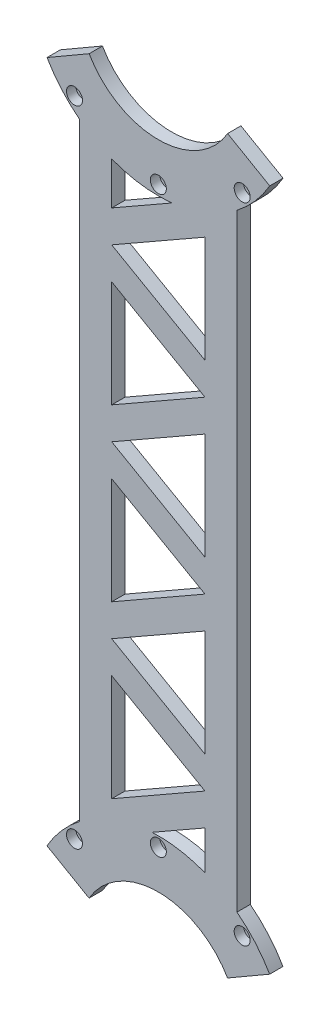
from build123d import *

# Parameters (mm, degrees)
SKETCH1_R           = 48.25
BOSS_EXTRUDE1_DEPTH = 5
SKETCH2_W           = 17.162038191
SKETCH2_H           = 56.822210482
SKETCH2_W_2         = 16.152506533
SKETCH2_H_2         = 65.186901365
CUT_EXTRUDE1_DEPTH  = 8
SKETCH3_R           = 30
CUT_EXTRUDE2_DEPTH  = 8
SKETCH4_R           = 1.75
CUT_EXTRUDE3_DEPTH  = 10
SKETCH9_R           = 3
CUT_EXTRUDE4_DEPTH  = 3.5
SKETCH12_R          = 48.25
BOSS_EXTRUDE4_DEPTH = 5
SKETCH13_W          = 17.162038191
SKETCH13_H          = 240.265998925
SKETCH13_W_2        = 16.152506533
SKETCH13_H_2        = 226.18217938
CUT_EXTRUDE5_DEPTH  = 5
SKETCH14_R          = 30
CUT_EXTRUDE6_DEPTH  = 5
CUT_EXTRUDE7_DEPTH  = 5
CUT_EXTRUDE8_DEPTH  = 5
SKETCH19_R          = 1.75
CUT_EXTRUDE9_DEPTH  = 5
SKETCH20_R          = 3
CUT_EXTRUDE10_DEPTH = 3.5
BOSS_EXTRUDE5_DEPTH = 5
SKETCH21_R          = 30
CUT_EXTRUDE11_DEPTH = 5
SKETCH22_R          = 3
CUT_EXTRUDE12_DEPTH = 3.5


with BuildPart() as part:
    # Sketch1 → Boss-Extrude1 (new body)
    with BuildSketch(Plane.XY):
        Circle(SKETCH1_R)
    extrude(amount=-BOSS_EXTRUDE1_DEPTH)

    # Sketch2 → Cut-Extrude1 (cut)
    with BuildSketch(Plane.XY):
        with Locations((-54.831019095, 0)):
            Rectangle(SKETCH2_W, SKETCH2_H)
        with Locations((54.326253267, -4.182345442)):
            Rectangle(SKETCH2_W_2, SKETCH2_H_2)
    extrude(amount=-CUT_EXTRUDE1_DEPTH, mode=Mode.SUBTRACT)

    # Sketch3 → Cut-Extrude2 (cut)
    with BuildSketch(Plane.XY):
        Circle(SKETCH3_R)
    extrude(amount=-CUT_EXTRUDE2_DEPTH, mode=Mode.SUBTRACT)

    # Sketch4 → Cut-Extrude3 (cut)
    with BuildSketch(Plane.XY):
        with Locations((-42.5, 0)):
            Circle(SKETCH4_R)
        with Locations((0, -44.5)):
            Circle(SKETCH4_R)
        with Locations((0, 44.5)):
            Circle(SKETCH4_R)
        with Locations((42.5, 0)):
            Circle(SKETCH4_R)
        with Locations((-31.466251763, -31.466251763)):
            Circle(SKETCH4_R)
        with Locations((31.466251763, -31.466251763)):
            Circle(SKETCH4_R)
        with Locations((31.466251763, 31.466251763)):
            Circle(SKETCH4_R)
        with Locations((-31.466251763, 31.466251763)):
            Circle(SKETCH4_R)
    extrude(amount=-CUT_EXTRUDE3_DEPTH, mode=Mode.SUBTRACT)

    # Sketch9 → Cut-Extrude4 (cut)
    with BuildSketch(Plane.XY):
        with Locations((-42.5, 0)):
            Circle(SKETCH9_R)
        with Locations((42.5, 0)):
            Circle(SKETCH9_R)
        with Locations((31.466251763, 31.466251763)):
            Circle(SKETCH9_R)
        with Locations((-31.466251763, 31.466251763)):
            Circle(SKETCH9_R)
        with Locations((-31.466251763, -31.466251763)):
            Circle(SKETCH9_R)
        with Locations((31.466251763, -31.466251763)):
            Circle(SKETCH9_R)
        with Locations((0, -44.5)):
            Circle(SKETCH9_R)
        with Locations((0, 44.5)):
            Circle(SKETCH9_R)
    extrude(amount=-CUT_EXTRUDE4_DEPTH, mode=Mode.SUBTRACT)

    # Sketch17 → Cut-Extrude7 (cut)
    with BuildSketch(Plane.XY):
        Polygon((0, 0), (-69.304284442, 39.961433382), (-69.278270797, -65.322297693), (63.970930278, -62.407226987), (69.259758702, 40.038554227), align=None)
    extrude(amount=-CUT_EXTRUDE7_DEPTH, mode=Mode.SUBTRACT)



with BuildPart() as body_2:
    # Sketch12 → Boss-Extrude4 (new body)
    with BuildSketch(Plane.XY):
        with Locations((0, 304.453033425)):
            Circle(SKETCH12_R)
    extrude(amount=-BOSS_EXTRUDE4_DEPTH)

    # Sketch13 → Cut-Extrude5 (cut)
    with BuildSketch(Plane.XY):
        with Locations((-54.831019095, 316.834631882)):
            Rectangle(SKETCH13_W, SKETCH13_H)
        with Locations((54.326253267, 300.281083797)):
            Rectangle(SKETCH13_W_2, SKETCH13_H_2)
    extrude(amount=-CUT_EXTRUDE5_DEPTH, mode=Mode.SUBTRACT)

    # Sketch14 → Cut-Extrude6 (cut)
    with BuildSketch(Plane.XY):
        with Locations((0, 304.453033425)):
            Circle(SKETCH14_R)
    extrude(amount=-CUT_EXTRUDE6_DEPTH, mode=Mode.SUBTRACT)

    # Sketch18 → Cut-Extrude8 (cut)
    with BuildSketch(Plane.XY):
        Polygon((0, 304.453033425), (-69.251773631, 264.400669588), (-69.066382196, 357.511219566), (54.70167511, 362.333351669), (69.31225138, 264.505420122), align=None)
    extrude(amount=-CUT_EXTRUDE8_DEPTH, mode=Mode.SUBTRACT)

    # Sketch19 → Cut-Extrude9 (cut)
    with BuildSketch(Plane.XY):
        with Locations((0, 259.953033425)):
            Circle(SKETCH19_R)
        with Locations((-31.466251763, 272.986781662)):
            Circle(SKETCH19_R)
        with Locations((31.466251763, 272.986781662)):
            Circle(SKETCH19_R)
    extrude(amount=-CUT_EXTRUDE9_DEPTH, mode=Mode.SUBTRACT)

    # Sketch20 → Cut-Extrude10 (cut)
    with BuildSketch(Plane.XY):
        with Locations((-31.466251763, 272.986781662)):
            Circle(SKETCH20_R)
        with Locations((0, 259.953033425)):
            Circle(SKETCH20_R)
        with Locations((31.466251763, 272.986781662)):
            Circle(SKETCH20_R)
    extrude(amount=-CUT_EXTRUDE10_DEPTH, mode=Mode.SUBTRACT)


with BuildPart() as part_1:
    add(part.part)

    add(body_2.part)  # Boss-Extrude5 merges body 2
    # Sketch10 → Boss-Extrude5 (add)
    # profile 1 of 4: a face of its own
    with BuildSketch(Plane.XY):
        with BuildLine():
            Line((-17.5, 243.53997423), (-17.5, 259.48846404))
            ThreePointArc((-17.5, 259.48846404), (-23.743486454, 262.449350837), (-29.5, 266.271722552))
            Line((-29.5, 266.271722552), (-29.5, 38.181310873))
            ThreePointArc((-29.5, 38.181310873), (-16.697131744, 45.268844601), (-2.358379682, 48.192328697))
            Line((-2.358379682, 48.192328697), (17.5, 59.53997423))
            Line((17.5, 59.53997423), (17.5, 44.964569385))
            ThreePointArc((17.5, 44.964569385), (23.743486454, 42.003682588), (29.5, 38.181310873))
            Line((29.5, 38.181310873), (29.5, 266.271722552))
            ThreePointArc((29.5, 266.271722552), (17.999468175, 259.686062951), (5.141024697, 256.477702628))
            Line((5.141024697, 256.477702628), (-17.5, 243.53997423))
        make_face()
        Polygon((17.5, 251.53997423), (17.5, 211.53997423), (-17.5, 231.53997423), align=None, mode=Mode.SUBTRACT)
        Polygon((17.5, 187.53997423), (17.5, 147.53997423), (-17.5, 167.53997423), align=None, mode=Mode.SUBTRACT)
        Polygon((-17.5, 179.53997423), (-17.5, 219.53997423), (17.5, 199.53997423), align=None, mode=Mode.SUBTRACT)
        Polygon((17.5, 135.53997423), (-17.5, 115.53997423), (-17.5, 155.53997423), align=None, mode=Mode.SUBTRACT)
        Polygon((17.5, 123.53997423), (17.5, 83.53997423), (-17.5, 103.53997423), align=None, mode=Mode.SUBTRACT)
        Polygon((17.5, 71.53997423), (-17.5, 51.53997423), (-17.5, 91.53997423), align=None, mode=Mode.SUBTRACT)
    # profile 2 of 4: a face of its own
    with BuildSketch(Plane.XY):
        with BuildLine():
            ThreePointArc((29.101447707, 274.83277781), (28.479675874, 272.7032954), (29.490995443, 270.728826288))
            ThreePointArc((29.490995443, 270.728826288), (29.367996239, 272.787614912), (29.101447707, 274.83277781))
        make_face()
    # profile 3 of 4: a face of its own
    with BuildSketch(Plane.XY):
        with BuildLine():
            ThreePointArc((-29.101447707, 274.83277781), (-29.367996239, 272.787614912), (-29.490995443, 270.728826288))
            ThreePointArc((-29.490995443, 270.728826288), (-28.479675874, 272.7032954), (-29.101447707, 274.83277781))
        make_face()
    # profile 4 of 4: a face of its own
    with BuildSketch(Plane.XY):
        with BuildLine():
            ThreePointArc((-24.25254041, 286.794769533), (0, 274.453033425), (24.25254041, 286.794769533))
            ThreePointArc((24.25254041, 286.794769533), (0, 299.5), (-24.25254041, 286.794769533))
        make_face()
    extrude(amount=-BOSS_EXTRUDE5_DEPTH)

    # Sketch21 → Cut-Extrude11 (cut)
    with BuildSketch(Plane.XY):
        with Locations((0, 304.453033425)):
            Circle(SKETCH21_R)
    extrude(amount=-CUT_EXTRUDE11_DEPTH, mode=Mode.SUBTRACT)

    # Sketch22 → Cut-Extrude12 (cut)
    with BuildSketch(Plane.XY):
        with Locations((31.466251763, 272.986781662)):
            Circle(SKETCH22_R)
        with Locations((-31.466251763, 272.986781662)):
            Circle(SKETCH22_R)
    extrude(amount=-CUT_EXTRUDE12_DEPTH, mode=Mode.SUBTRACT)


solid = part_1.part
